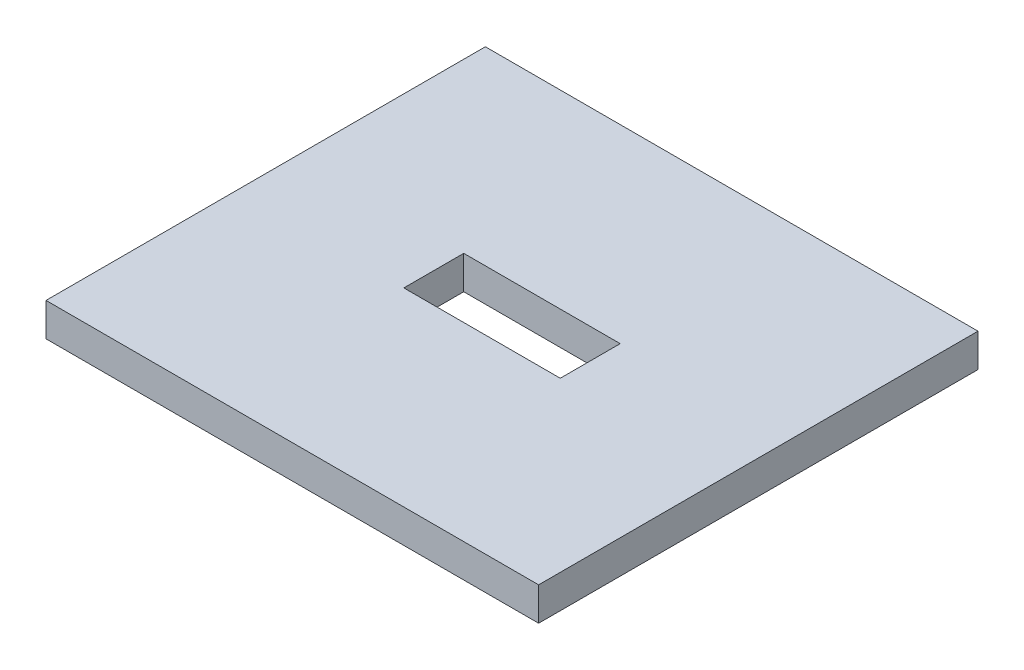
from build123d import *

# Parameters (mm, degrees)
IZIM1_W                     = 74
IZIM1_H                     = 66
IZIM1_W_2                   = 23.5
IZIM1_H_2                   = 9
Y_KSEKLIK_EKSTR_ZYON1_DEPTH = 5


with BuildPart() as part:
    # Çizim1 → Yükseklik-Ekstrüzyon1 (new body)
    with BuildSketch(Plane(origin=(0, 0, 0), x_dir=(1, 0, 0), z_dir=(0, 1, 0))):
        with Locations((37, 33)):
            Rectangle(IZIM1_W, IZIM1_H)
        with Locations((37, 33)):
            Rectangle(IZIM1_W_2, IZIM1_H_2, mode=Mode.SUBTRACT)
    extrude(amount=Y_KSEKLIK_EKSTR_ZYON1_DEPTH)


solid = part.part
